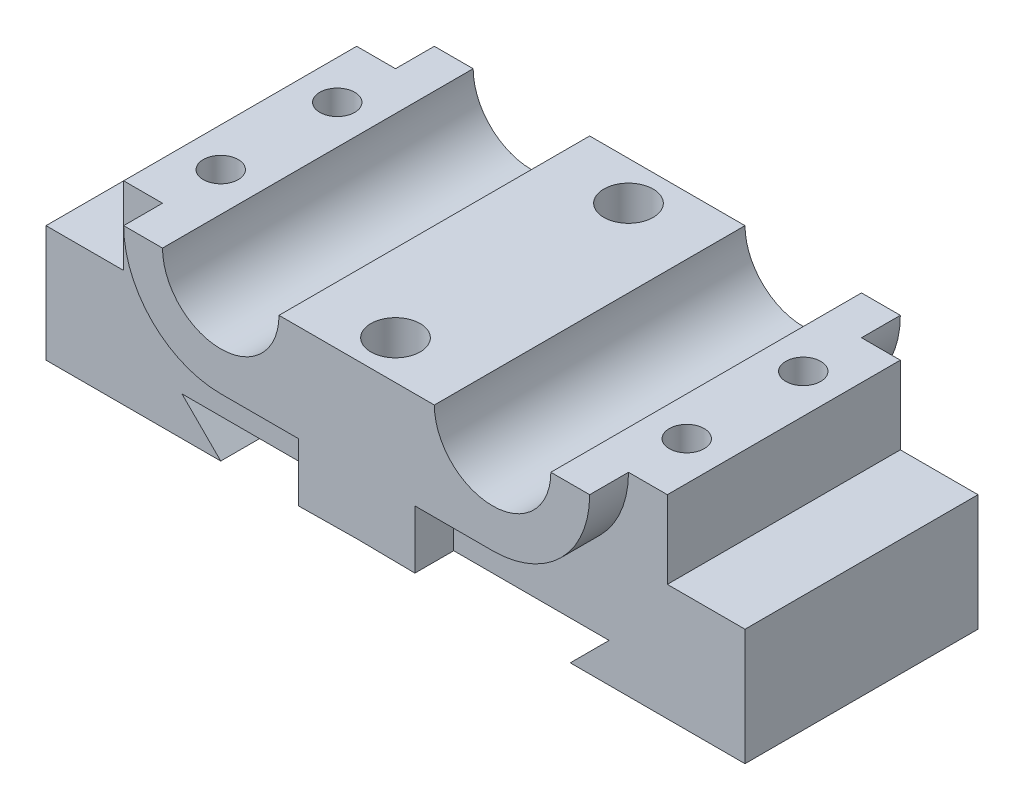
from build123d import *

# Parameters (mm, degrees)
BOSS_EXTRUDE1_DEPTH      = 30
BOSS_EXTRUDE2_DEPTH      = 5
BOSS_EXTRUDE2_DEPTH_BACK = 35
SKETCH3_R                = 3.173895943
SKETCH3_R_2              = 2.25
CUT_EXTRUDE1_DEPTH       = 15


with BuildPart() as part:
    # Sketch1 → Boss-Extrude1 (new body)
    with BuildSketch(Plane.XY):
        with BuildLine():
            Line((-45, 9.906496063), (-45, -5.093503937))
            Line((-45, -5.093503937), (-22.5, -5.093503937))
            Line((-22.5, -5.093503937), (-27.5, -0.093503937))
            Line((-27.5, -0.093503937), (27.5, -0.093503937))
            Line((27.5, -0.093503937), (22.5, -5.093503937))
            Line((22.5, -5.093503937), (45, -5.093503937))
            Line((45, -5.093503937), (45, 9.906496063))
            Line((45, 9.906496063), (35, 9.906496063))
            Line((35, 9.906496063), (35, 19.906496063))
            Line((35, 19.906496063), (25, 19.906496063))
            ThreePointArc((25, 19.906496063), (17.5, 12.406496063), (10, 19.906496063))
            Line((10, 19.906496063), (-10, 19.906496063))
            ThreePointArc((-10, 19.906496063), (-17.5, 12.406496063), (-25, 19.906496063))
            Line((-25, 19.906496063), (-35, 19.906496063))
            Line((-35, 19.906496063), (-35, 9.906496063))
            Line((-35, 9.906496063), (-45, 9.906496063))
        make_face()
    extrude(amount=BOSS_EXTRUDE1_DEPTH)

    # Sketch2 → Boss-Extrude2 (add, two sides: drawn at the far end of the back side and taken through both)
    with BuildSketch(Plane.XY.offset(30).offset(-BOSS_EXTRUDE2_DEPTH_BACK)):
        with BuildLine():
            Line((-7.5, -0.093503937), (0, 0))
            Line((0, 0), (7.5, -0.093503937))
            Line((7.5, -0.093503937), (7.5, 7.406496063))
            Line((7.5, 7.406496063), (17.5, 7.406496063))
            ThreePointArc((17.5, 7.406496063), (26.338834765, 11.067661298), (30, 19.906496063))
            Line((30, 19.906496063), (25, 19.906496063))
            ThreePointArc((25, 19.906496063), (17.5, 12.406496063), (10, 19.906496063))
            Line((10, 19.906496063), (-10, 19.906496063))
            ThreePointArc((-10, 19.906496063), (-17.5, 12.406496063), (-25, 19.906496063))
            Line((-25, 19.906496063), (-30, 19.906496063))
            ThreePointArc((-30, 19.906496063), (-26.338834765, 11.067661298), (-17.5, 7.406496063))
            Line((-17.5, 7.406496063), (-7.5, 7.406496063))
            Line((-7.5, 7.406496063), (-7.5, -0.093503937))
        make_face()
    extrude(amount=BOSS_EXTRUDE2_DEPTH + BOSS_EXTRUDE2_DEPTH_BACK)

    # Sketch3 → Cut-Extrude1 (cut)
    with BuildSketch(Plane(origin=(0, 19.906496063, 0), x_dir=(1, 0, 0), z_dir=(0, 1, 0))):
        with Locations(Location((0, 0, 0), (0, 0, 270))):
            Circle(SKETCH3_R)
        with Locations(Location((-30, -7.5, 0), (0, 0, 270))):
            Circle(SKETCH3_R_2)
        with Locations(Location((30, -7.5, 0), (0, 0, 90))):
            Circle(SKETCH3_R_2)
        with Locations(Location((30, -22.5, 0), (0, 0, 270))):
            Circle(SKETCH3_R_2)
        with Locations(Location((0, -30, 0), (0, 0, 90))):
            Circle(SKETCH3_R)
        with Locations(Location((-30, -22.5, 0), (0, 0, 90))):
            Circle(SKETCH3_R_2)
    extrude(amount=-CUT_EXTRUDE1_DEPTH, mode=Mode.SUBTRACT)


solid = part.part
